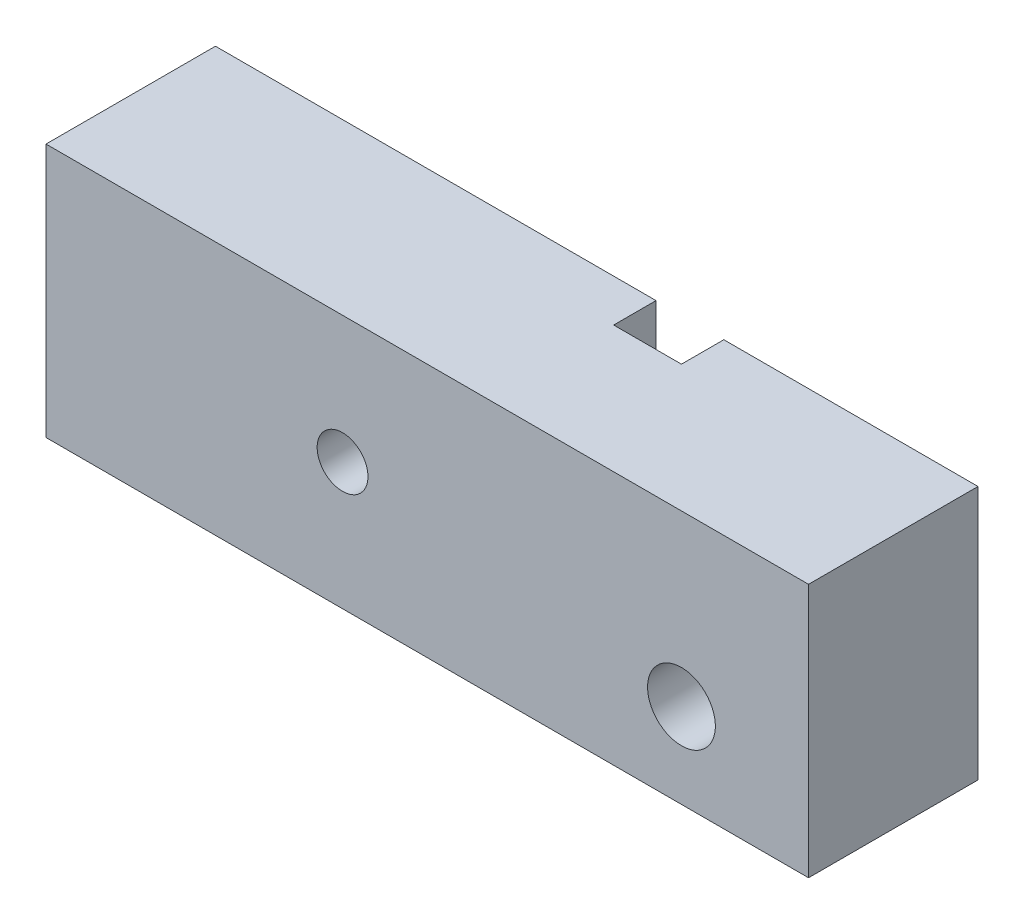
from build123d import *

# Parameters (mm, degrees)
SKETCH_1_W          = 90
SKETCH_1_H          = 30
EXTRUDE_1_DEPTH     = 20
SKETCH_3_R          = 6
CUT_EXTRUDE_1_DEPTH = 12
SKETCH_4_R          = 3
CUT_EXTRUDE_2_DEPTH = 49.928519291
SKETCH_5_W          = 8
SKETCH_5_H          = 5
CUT_EXTRUDE_3_DEPTH = 58.662812973
SKETCH_6_R          = 4
CUT_EXTRUDE_4_DEPTH = 52.478150705


with BuildPart() as part:
    # Эскиз1 → Бобышка-Вытянуть1 (new body)
    with BuildSketch(Plane.XY):
        Rectangle(SKETCH_1_W, SKETCH_1_H)
    extrude(amount=EXTRUDE_1_DEPTH)

    # Эскиз2 → Вырез-Повернуть1 (revolve, cut)
    with BuildSketch(Plane(origin=(0, 0, 0), x_dir=(1, 0, 0), z_dir=(0, 1, 0)), mode=Mode.PRIVATE) as cut_revolve_1_sk:
        Polygon((-30, 0), (-26, 0), (-26, -10), (-30, -14), align=None)
    revolve(cut_revolve_1_sk.sketch.rotate(Axis((-30, 0, 0), (0, 0, 1)), 180), axis=Axis((-30, 0, 0), (0, 0, 1)), mode=Mode.SUBTRACT)

    # Эскиз3 → Вырез-Вытянуть1 (cut)
    with BuildSketch(Plane(origin=(0, 0, 0), x_dir=(-1, 0, 0), z_dir=(0, 0, -1))):
        with Locations((10, 0)):
            Circle(SKETCH_3_R)
    extrude(amount=-CUT_EXTRUDE_1_DEPTH, mode=Mode.SUBTRACT)

    # Эскиз4 → Вырез-Вытянуть2 (cut, through all)
    with BuildSketch(Plane(origin=(0, 0, 12), x_dir=(-1, 0, 0), z_dir=(0, 0, -1))):
        with Locations((10, 0)):
            Circle(SKETCH_4_R)
    extrude(amount=-CUT_EXTRUDE_2_DEPTH, mode=Mode.SUBTRACT)

    # Эскиз5 → Вырез-Вытянуть3 (cut, through all)
    with BuildSketch(Plane(origin=(0, 15, 0), x_dir=(1, 0, 0), z_dir=(0, 1, 0))):
        with Locations((11, -2.5)):
            Rectangle(SKETCH_5_W, SKETCH_5_H)
    extrude(amount=-CUT_EXTRUDE_3_DEPTH, mode=Mode.SUBTRACT)

    # Эскиз6 → Вырез-Вытянуть4 (cut, through all)
    with BuildSketch(Plane(origin=(0, 0, 0), x_dir=(-1, 0, 0), z_dir=(0, 0, -1))):
        with Locations((-30, -5)):
            Circle(SKETCH_6_R)
    extrude(amount=-CUT_EXTRUDE_4_DEPTH, mode=Mode.SUBTRACT)


solid = part.part
